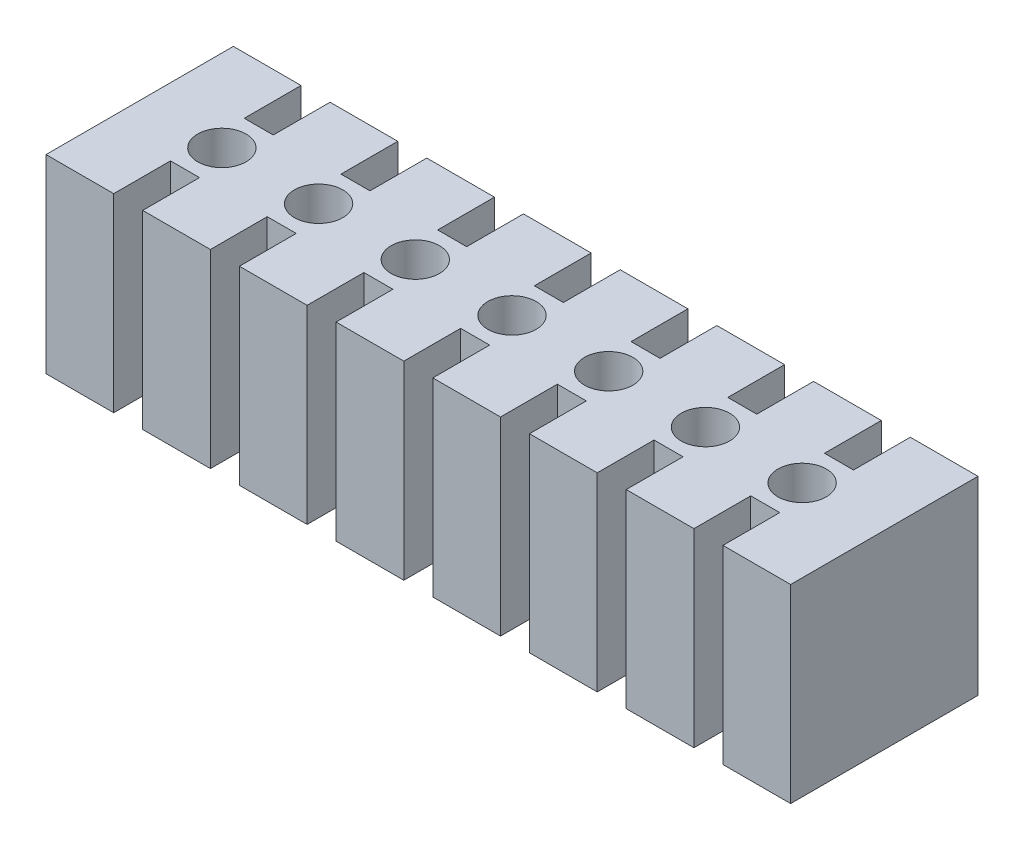
from build123d import *

# Parameters (mm, degrees)
BOSS_EXTRUDE1_DEPTH = 15.7
LPATTERN1_COUNT     = 8
LPATTERN1_PITCH     = 8
SKETCH2_W           = 1.2
SKETCH2_H           = 6.1
CUT_EXTRUDE1_DEPTH  = 67.562602113
SKETCH3_W           = 0.8
SKETCH3_H           = 3.2
BOSS_EXTRUDE2_DEPTH = 15.7


with BuildPart() as part:
    # Sketch1 → Boss-Extrude1 (new body)
    with BuildSketch(Plane(origin=(0, 0, 0), x_dir=(1, 0, 0), z_dir=(0, 1, 0))):
        with BuildLine():
            Line((0, 10.8), (0, 15.5))
            Line((0, 15.5), (5.6, 15.5))
            Line((5.6, 15.5), (5.6, 10.8))
            Line((5.6, 10.8), (6.8, 10.8))
            Line((6.8, 10.8), (6.8, 9.75))
            ThreePointArc((6.8, 9.75), (4.8, 7.75), (6.8, 5.75))
            Line((6.8, 5.75), (6.8, 4.7))
            Line((6.8, 4.7), (5.6, 4.7))
            Line((5.6, 4.7), (5.6, 0))
            Line((5.6, 0), (0, 0))
            Line((0, 0), (0, 4.7))
            Line((0, 4.7), (-1.2, 4.7))
            Line((-1.2, 4.7), (-1.2, 5.75))
            ThreePointArc((-1.2, 5.75), (0.8, 7.75), (-1.2, 9.75))
            Line((-1.2, 9.75), (-1.2, 10.8))
            Line((-1.2, 10.8), (0, 10.8))
        make_face()
    boss_extrude1 = extrude(amount=BOSS_EXTRUDE1_DEPTH)

    # LPattern1: Boss-Extrude1 ×8
    with Locations(*[(i * LPATTERN1_PITCH, 0, 0) for i in range(1, LPATTERN1_COUNT)]):
        add(boss_extrude1)

    # Sketch2 → Cut-Extrude1 (cut, through all)
    with BuildSketch(Plane(origin=(0, 15.7, 0), x_dir=(1, 0, 0), z_dir=(0, 1, 0))):
        with Locations((-0.6, 7.75)):
            Rectangle(SKETCH2_W, SKETCH2_H)
        with Locations((62.2, 7.75)):
            Rectangle(SKETCH2_W, SKETCH2_H)
    extrude(amount=-CUT_EXTRUDE1_DEPTH, mode=Mode.SUBTRACT)

    # Sketch3 → Boss-Extrude2 (add)
    with BuildSketch(Plane(origin=(0, 15.7, 0), x_dir=(1, 0, 0), z_dir=(0, 1, 0))):
        with Locations((0.4, 7.75)):
            Rectangle(SKETCH3_W, SKETCH3_H)
        with Locations((61.2, 7.75)):
            Rectangle(SKETCH3_W, SKETCH3_H)
    extrude(amount=-BOSS_EXTRUDE2_DEPTH)


solid = part.part
